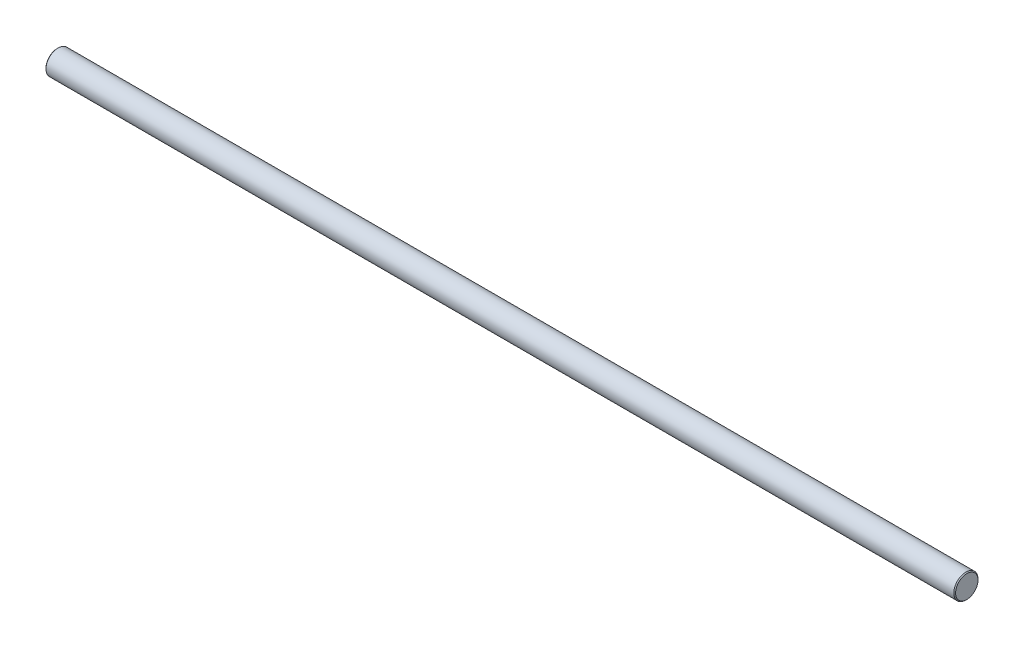
from build123d import *

# Parameters (mm, degrees)
SKETCH1_W     = 300
SKETCH1_H     = 4
CHAMFER1_SIZE = 0.3


with BuildPart() as part:
    # Sketch1 → Revolve1 (revolve)
    with BuildSketch(Plane.XY, mode=Mode.PRIVATE) as revolve1_sk:
        with Locations((150, 2)):
            Rectangle(SKETCH1_W, SKETCH1_H)
    revolve(revolve1_sk.sketch.rotate(Axis((0, 0, 0), (1, 0, 0)), 90), axis=Axis((0, 0, 0), (1, 0, 0)))

    # Chamfer1
    chamfer1_edges = [part.edges().sort_by_distance(p)[0] for p in [
        (300, 0, -4),
        (0, 0, -4),
    ]]
    chamfer(chamfer1_edges, length=CHAMFER1_SIZE)


solid = part.part
